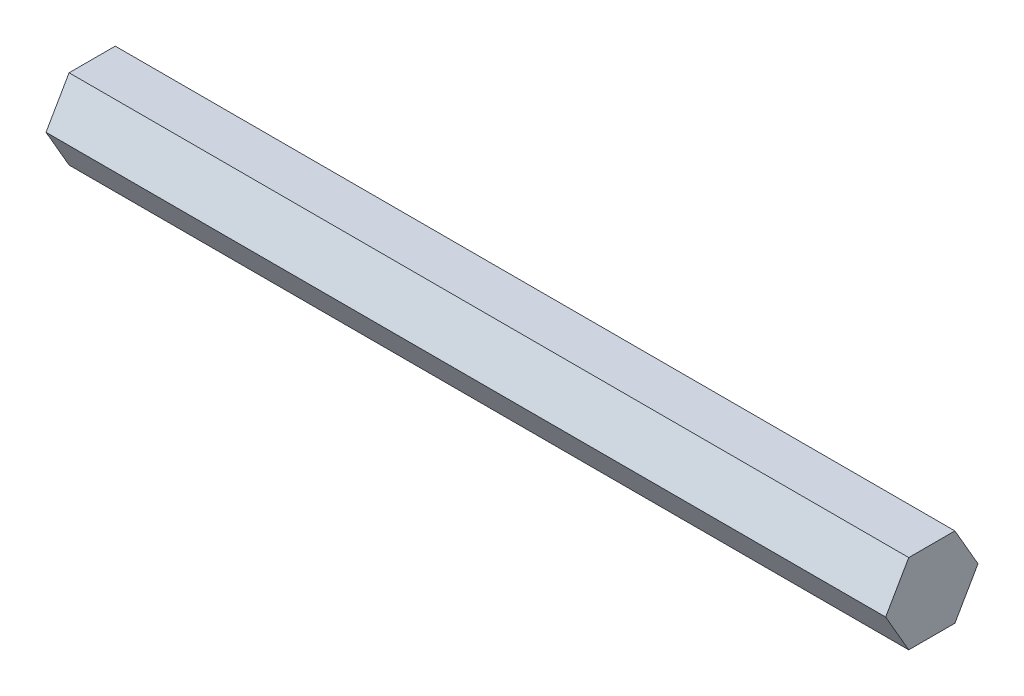
from build123d import *

# Parameters (mm, degrees)
BOSS_EXTRUDE1_DEPTH = 133.35


with BuildPart() as part:
    # Sketch1 → Boss-Extrude1 (new body)
    with BuildSketch(Plane(origin=(0, 0, 0), x_dir=(0, 0, -1), z_dir=(1, 0, 0))):
        Polygon((7.332348419, 0), (3.666174209, 6.35), (-3.666174209, 6.35), (-7.332348419, 0), (-3.666174209, -6.35), (3.666174209, -6.35), align=None)
    extrude(amount=BOSS_EXTRUDE1_DEPTH)


solid = part.part
